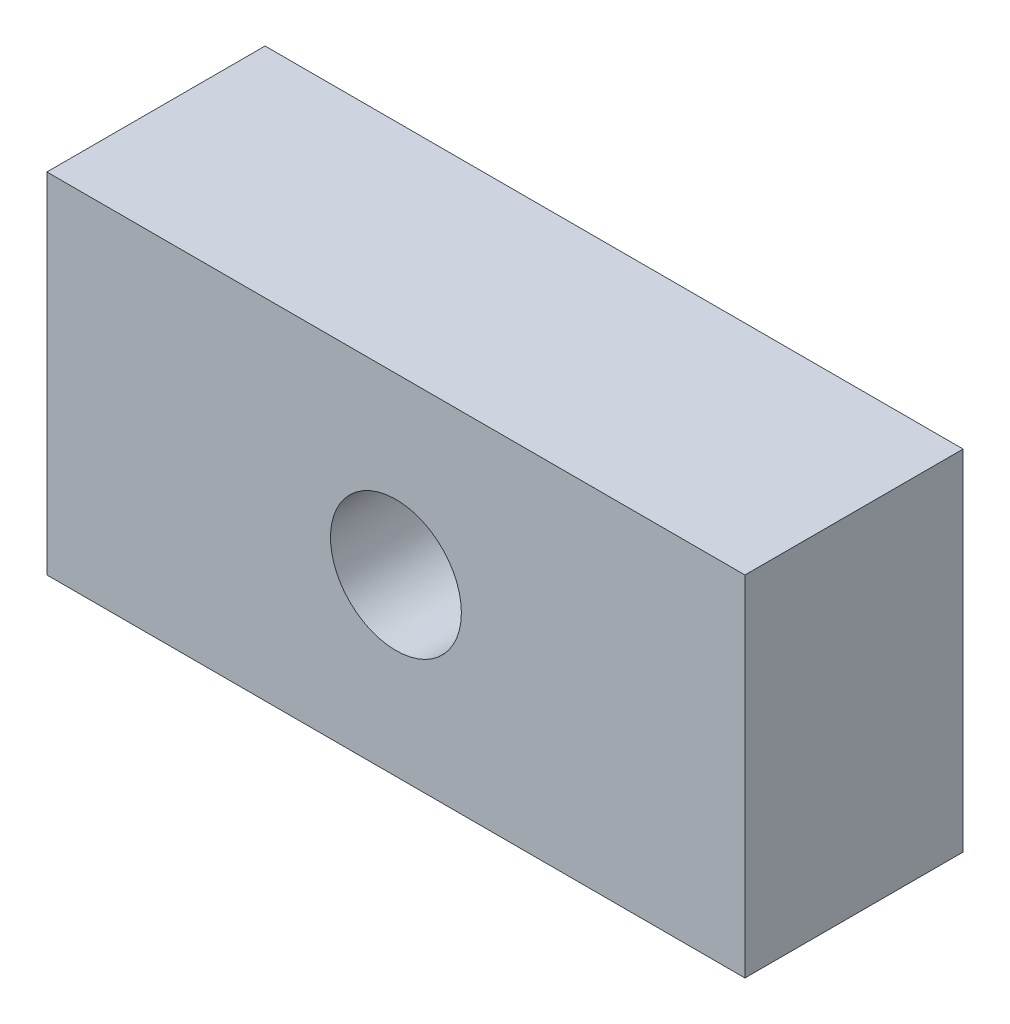
from build123d import *

# Parameters (mm, degrees)
SKETCH2_W           = 101.6
SKETCH2_H           = 50.8
SKETCH2_R           = 9.525
BOSS_EXTRUDE1_DEPTH = 31.75


with BuildPart() as part:
    # Sketch2 → Boss-Extrude1 (new body)
    with BuildSketch(Plane.XY):
        with Locations((50.8, 25.4)):
            Rectangle(SKETCH2_W, SKETCH2_H)
        with Locations((50.8, 25.4)):
            Circle(SKETCH2_R, mode=Mode.SUBTRACT)
    extrude(amount=BOSS_EXTRUDE1_DEPTH)


solid = part.part
